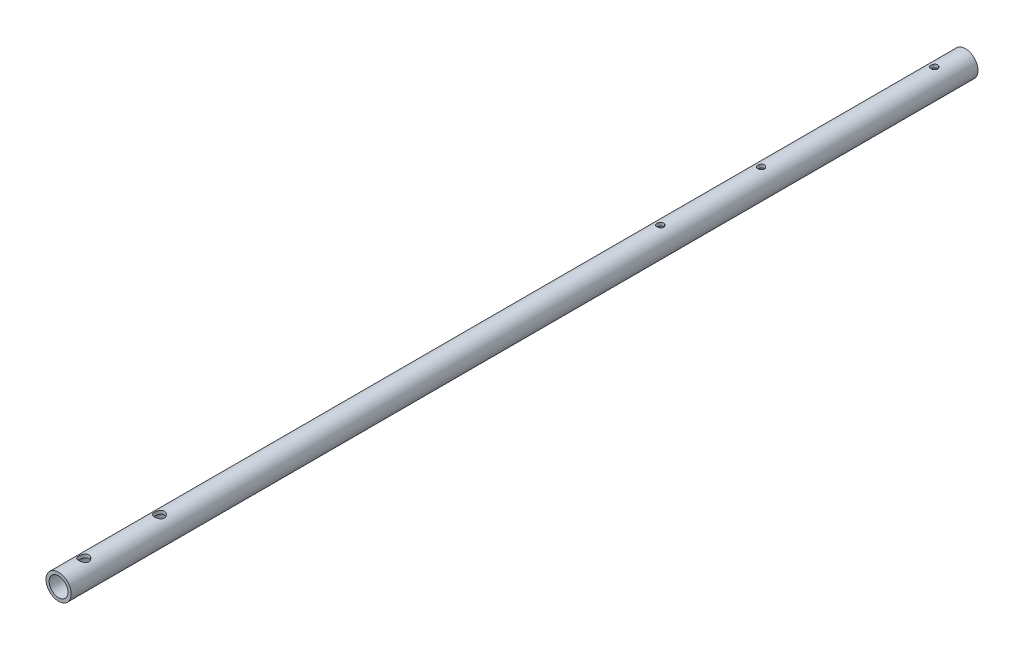
from build123d import *

# Parameters (mm, degrees)
SKETCH1_R               = 12.7
SKETCH1_R_2             = 9.525
BOSS_EXTRUDE1_DEPTH     = 914.4
F_1_4_CLEARANCE_HOLE2_D = 6.7564
F_3_8_CLEARANCE_HOLE1_D = 10.0838


with BuildPart() as part:
    # Sketch1 → Boss-Extrude1 (new body)
    with BuildSketch(Plane.XY):
        Circle(SKETCH1_R)
        Circle(SKETCH1_R_2, mode=Mode.SUBTRACT)
    extrude(amount=BOSS_EXTRUDE1_DEPTH)

    # 1/4 Clearance Hole2 (through all)
    with Locations(Plane(origin=(0, -12.7, 0), x_dir=(-1, 0, 0), z_dir=(0, -1, 0))):
        with Locations((0, -206.121), (0, -31.496), (0, -307.721)):
            Hole(F_1_4_CLEARANCE_HOLE2_D / 2)

    # 3/8 Clearance Hole1 (through all)
    with Locations(Plane(origin=(0, -12.7, 0), x_dir=(-1, 0, 0), z_dir=(0, -1, 0))):
        with Locations((0, -889), (0, -812.8)):
            Hole(F_3_8_CLEARANCE_HOLE1_D / 2)


solid = part.part
